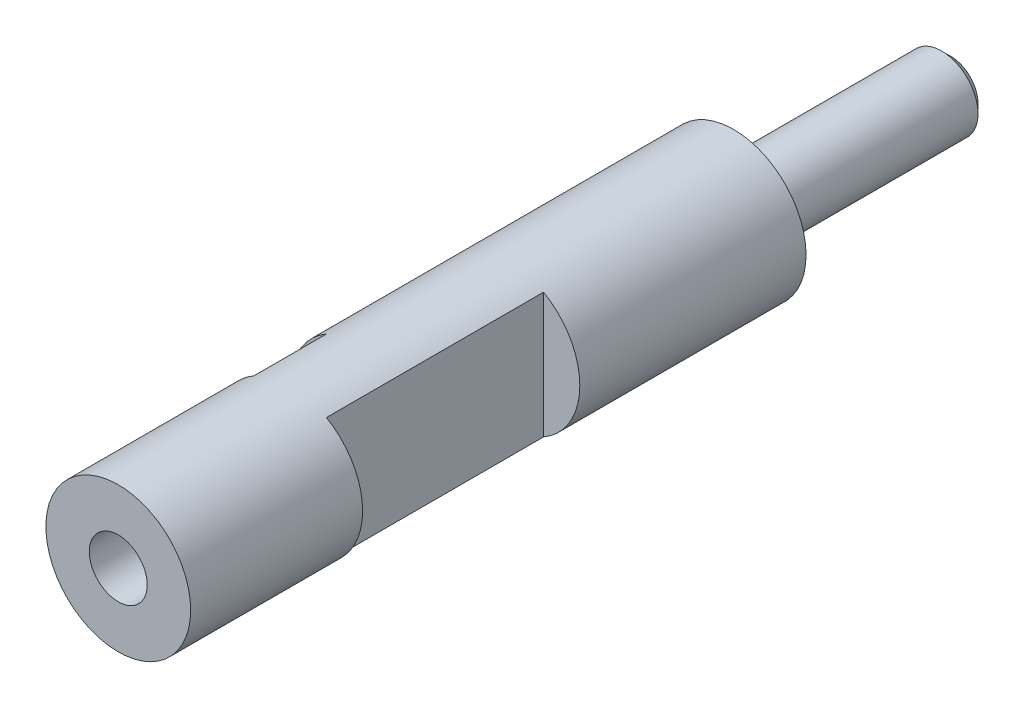
from build123d import *

# Parameters (mm, degrees)
SKETCH1_R                       = 2
BOSS_EXTRUDE1_DEPTH             = 12
CHAMFER1_SIZE                   = 0.5
SKETCH2_R                       = 4
BOSS_EXTRUDE2_DEPTH             = 34
SKETCH3_R                       = 1.6
CUT_EXTRUDE1_DEPTH              = 14
CUT_EXTRUDE2_DEPTH              = 47.346520905
CUT_EXTRUDE2_DEPTH_BACK         = 47.346520905
SKETCH4_W                       = 2
SKETCH4_H                       = 12
M3X0_5_TAPPED_HOLE1_D           = 2.5
M3X0_5_TAPPED_HOLE1_DEPTH       = 13.248924226
M3X0_5_TAPPED_HOLE1_CSINK_D     = 3.05
M3X0_5_TAPPED_HOLE1_CSINK_ANGLE = 90
M3X0_5_TAPPED_HOLE1_TIP         = 0.751075774
CUT_EXTRUDE3_DEPTH              = 47.346520905
CUT_EXTRUDE3_DEPTH_BACK         = 47.346520905
SKETCH7_W                       = 2
SKETCH7_H                       = 4
M3X0_5_TAPPED_HOLE3_D           = 2.5
M3X0_5_TAPPED_HOLE3_DEPTH       = 1.248924226
M3X0_5_TAPPED_HOLE3_CSINK_D     = 3.05
M3X0_5_TAPPED_HOLE3_CSINK_ANGLE = 90
M3X0_5_TAPPED_HOLE3_TIP         = 0.751075774


with BuildPart() as part:
    # Sketch1 → Boss-Extrude1 (new body)
    with BuildSketch(Plane.XY):
        Circle(SKETCH1_R)
    extrude(amount=BOSS_EXTRUDE1_DEPTH)

    # Chamfer1
    chamfer1_edges = [part.edges().sort_by_distance(p)[0] for p in [
        (-2, 0, 0),
    ]]
    chamfer(chamfer1_edges, length=CHAMFER1_SIZE)

    # Sketch2 → Boss-Extrude2 (add)
    with BuildSketch(Plane.XY.offset(12)):
        Circle(SKETCH2_R)
    extrude(amount=BOSS_EXTRUDE2_DEPTH)

    # Sketch3 → Cut-Extrude1 (cut)
    with BuildSketch(Plane.XY.offset(46)):
        Circle(SKETCH3_R)
    extrude(amount=-CUT_EXTRUDE1_DEPTH, mode=Mode.SUBTRACT)

    # Sketch4 → Cut-Extrude2 (cut, two sides: drawn at the far end of the back side and taken through both)
    with BuildSketch(Plane(origin=(0, 0, 0), x_dir=(1, 0, 0), z_dir=(0, 1, 0)).offset(-CUT_EXTRUDE2_DEPTH_BACK)):
        with Locations((3, -30.5)):
            Rectangle(SKETCH4_W, SKETCH4_H)
    extrude(amount=CUT_EXTRUDE2_DEPTH + CUT_EXTRUDE2_DEPTH_BACK, mode=Mode.SUBTRACT)

    # M3x0.5 Tapped Hole1
    with Locations(Plane.XY.offset(46)):
        with Locations((0, 0)):
            CounterSinkHole(M3X0_5_TAPPED_HOLE1_D / 2, M3X0_5_TAPPED_HOLE1_CSINK_D / 2, depth=M3X0_5_TAPPED_HOLE1_DEPTH, counter_sink_angle=M3X0_5_TAPPED_HOLE1_CSINK_ANGLE)
            with Locations((0, 0, -(M3X0_5_TAPPED_HOLE1_DEPTH + M3X0_5_TAPPED_HOLE1_TIP / 2))):  # 118° drill point
                Cone(0, M3X0_5_TAPPED_HOLE1_D / 2, M3X0_5_TAPPED_HOLE1_TIP, mode=Mode.SUBTRACT)

    # Sketch7 → Cut-Extrude3 (cut, two sides: drawn at the far end of the back side and taken through both)
    with BuildSketch(Plane(origin=(0, 0, 0), x_dir=(1, 0, 0), z_dir=(0, 1, 0)).offset(-CUT_EXTRUDE3_DEPTH_BACK)):
        with Locations((-3, -34.5)):
            Rectangle(SKETCH7_W, SKETCH7_H)
    extrude(amount=CUT_EXTRUDE3_DEPTH + CUT_EXTRUDE3_DEPTH_BACK, mode=Mode.SUBTRACT)

    # M3x0.5 Tapped Hole3
    with Locations(Plane(origin=(-2, -0.015660655, 34.578358954), x_dir=(0, 0, -1), z_dir=(-1, 0, 0))):
        with Locations((0, 0)):
            CounterSinkHole(M3X0_5_TAPPED_HOLE3_D / 2, M3X0_5_TAPPED_HOLE3_CSINK_D / 2, depth=M3X0_5_TAPPED_HOLE3_DEPTH, counter_sink_angle=M3X0_5_TAPPED_HOLE3_CSINK_ANGLE)
            with Locations((0, 0, -(M3X0_5_TAPPED_HOLE3_DEPTH + M3X0_5_TAPPED_HOLE3_TIP / 2))):  # 118° drill point
                Cone(0, M3X0_5_TAPPED_HOLE3_D / 2, M3X0_5_TAPPED_HOLE3_TIP, mode=Mode.SUBTRACT)


solid = part.part
